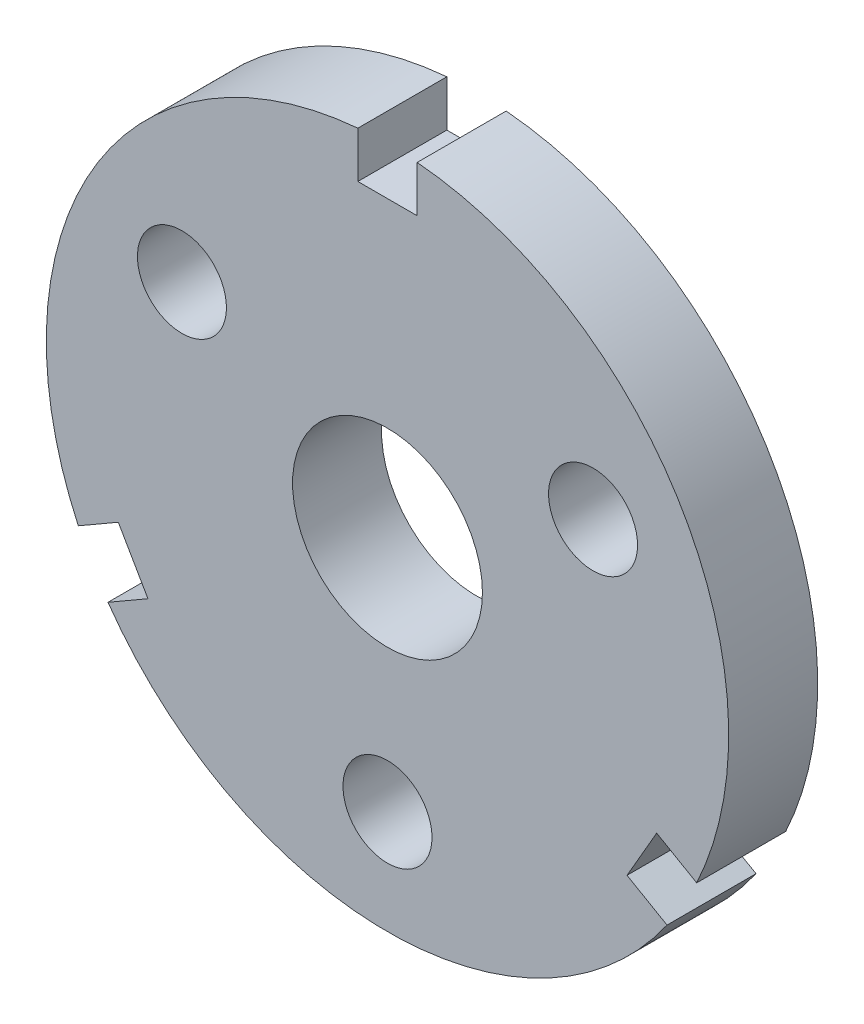
from build123d import *

# Parameters (mm, degrees)
SZKIC1_R                    = 7.5
SZKIC1_R_2                  = 16
DODANIE_WYCI_GNI_CIE1_DEPTH = 15


with BuildPart() as part:
    # Szkic1 → Dodanie-wyciągnięcie1 (new body)
    with BuildSketch(Plane.XY):
        with BuildLine():
            Line((-5, 49.5), (-5, 57.282196187))
            ThreePointArc((-5, 57.282196187), (-49.796460718, 28.75), (-52.107837082, -24.310971075))
            Line((-52.107837082, -24.310971075), (-45.368257487, -20.419872981))
            Line((-45.368257487, -20.419872981), (-40.368257487, -29.080127019))
            Line((-40.368257487, -29.080127019), (-47.107837082, -32.971225112))
            ThreePointArc((-47.107837082, -32.971225112), (0, -57.5), (47.107837082, -32.971225112))
            Line((47.107837082, -32.971225112), (40.368257487, -29.080127019))
            Line((40.368257487, -29.080127019), (45.368257487, -20.419872981))
            Line((45.368257487, -20.419872981), (52.107837082, -24.310971075))
            ThreePointArc((52.107837082, -24.310971075), (49.796460718, 28.75), (5, 57.282196187))
            Line((5, 57.282196187), (5, 49.5))
            Line((5, 49.5), (-5, 49.5))
        make_face()
        with Locations((34.641016151, 20)):
            Circle(SZKIC1_R, mode=Mode.SUBTRACT)
        with Locations((-34.641016151, 20)):
            Circle(SZKIC1_R, mode=Mode.SUBTRACT)
        with Locations((0, -40)):
            Circle(SZKIC1_R, mode=Mode.SUBTRACT)
        Circle(SZKIC1_R_2, mode=Mode.SUBTRACT)
    extrude(amount=DODANIE_WYCI_GNI_CIE1_DEPTH)


solid = part.part
